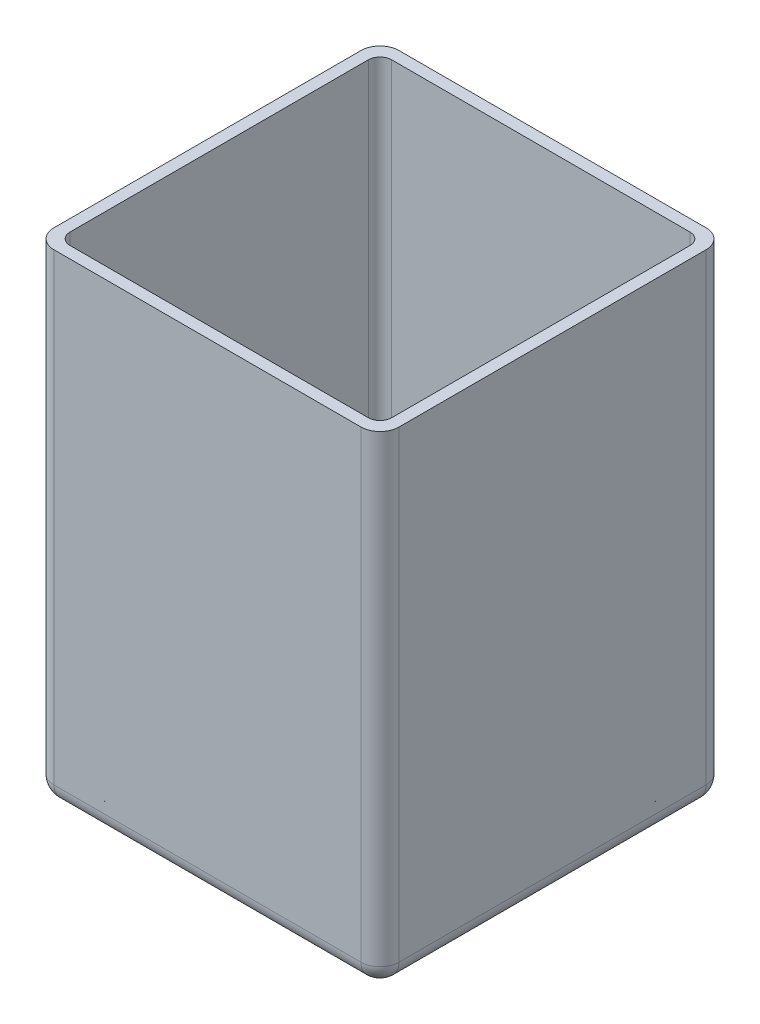
from build123d import *

# Parameters (mm, degrees)
SKETCH1_W           = 118
SKETCH1_H           = 118
BOSS_EXTRUDE1_DEPTH = 165
SHELL1_T            = -4
FILLET1_R           = 4
FILLET2_R           = 6.5


with BuildPart() as part:
    # Sketch1 → Boss-Extrude1 (new body)
    with BuildSketch(Plane(origin=(0, 0, 0), x_dir=(1, 0, 0), z_dir=(0, 1, 0))):
        Rectangle(SKETCH1_W, SKETCH1_H)
    extrude(amount=BOSS_EXTRUDE1_DEPTH)

    # Shell1
    shell1_openings = [part.faces().sort_by_distance(p)[0] for p in [
        (0, 165, 0),
    ]]
    offset(amount=SHELL1_T, openings=shell1_openings, kind=Kind.INTERSECTION)

    # Fillet1
    fillet1_edges = [part.edges().sort_by_distance(p)[0] for p in [
        (55, 4, 0),
        (55, 84.5, 55),
        (0, 4, -55),
        (55, 84.5, -55),
        (-55, 4, 0),
        (-55, 84.5, -55),
        (0, 4, 55),
        (-55, 84.5, 55),
    ]]
    fillet(fillet1_edges, radius=FILLET1_R)

    # Fillet2
    fillet2_edges = [part.edges().sort_by_distance(p)[0] for p in [
        (0, 0, 59),
        (-59, 0, 0),
        (0, 0, -59),
        (59, 0, 0),
        (59, 82.5, 59),
        (-59, 82.5, 59),
        (-59, 82.5, -59),
        (59, 82.5, -59),
    ]]
    fillet(fillet2_edges, radius=FILLET2_R)


solid = part.part
